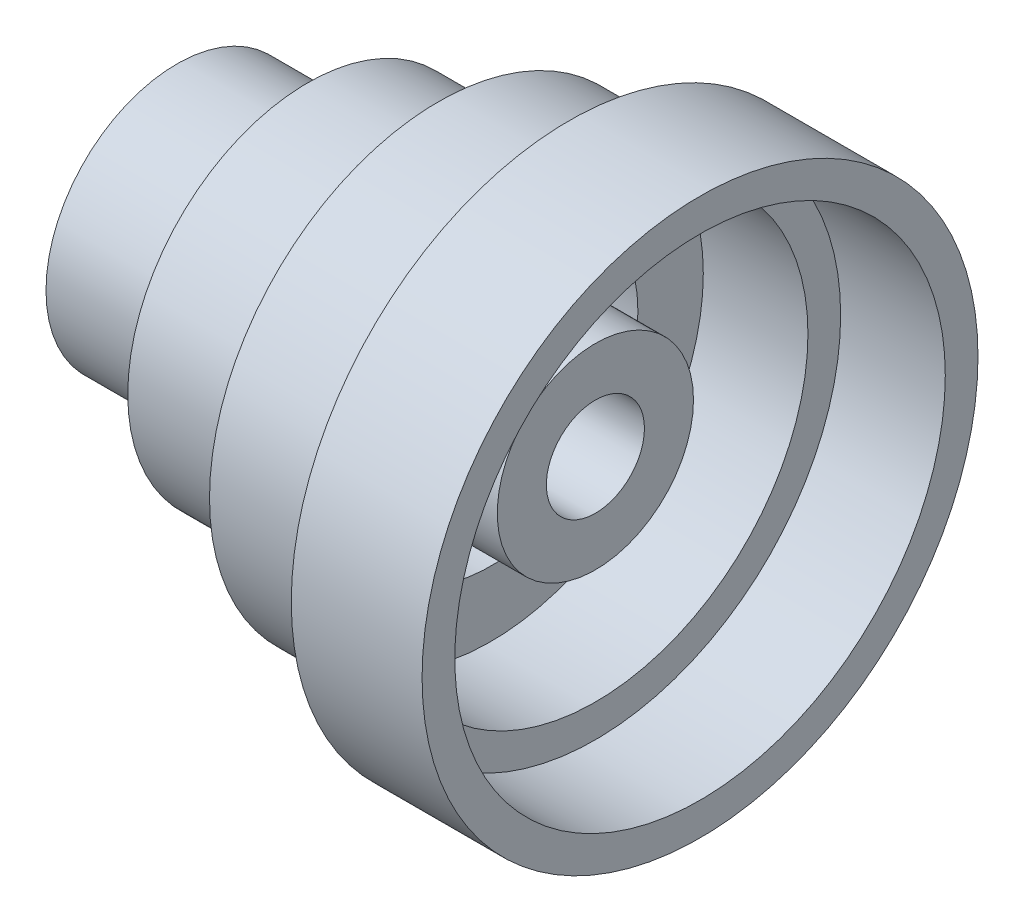
from build123d import *

# Parameters (mm, degrees)
SKETCH5_R                      = 1905
CUT_EXTRUDE2_DEPTH             = 812.8
SKETCH6_R                      = 1651
CUT_EXTRUDE3_DEPTH             = 812.8
SKETCH8_R                      = 1143
CUT_EXTRUDE5_DEPTH             = 812.8
SKETCH11_R                     = 762
BOSS_EXTRUDE2_DEPTH            = 3251.2
CUT_EXTRUDE7_REACH             = 5085.174
SKETCH12_R                     = 381
CUT_EXTRUDE7_DIRECTION_2_DEPTH = 5084.174008432


with BuildPart() as part:
    # Sketch1 → Revolve1 (revolve)
    with BuildSketch(Plane.XY, mode=Mode.PRIVATE) as revolve1_sk:
        Polygon((0, 381), (0, 1016), (1016, 1016), (1016, 1397), (2032, 1397), (2032, 1778), (3048, 1778), (3048, 2159), (4064, 2159), (4064, 381), align=None)
    revolve(revolve1_sk.sketch.rotate(Axis((0, 0, 0), (1, 0, 0)), 90), axis=Axis((0, 0, 0), (1, 0, 0)))

    # Sketch5 → Cut-Extrude2 (cut)
    with BuildSketch(Plane(origin=(4064, 0, 0), x_dir=(0, 0, -1), z_dir=(1, 0, 0))):
        Circle(SKETCH5_R)
    extrude(amount=-CUT_EXTRUDE2_DEPTH, mode=Mode.SUBTRACT)

    # Sketch6 → Cut-Extrude3 (cut)
    with BuildSketch(Plane(origin=(3251.2, 0, 0), x_dir=(0, 0, -1), z_dir=(1, 0, 0))):
        Circle(SKETCH6_R)
    extrude(amount=-CUT_EXTRUDE3_DEPTH, mode=Mode.SUBTRACT)

    # Sketch8 → Cut-Extrude5 (cut)
    with BuildSketch(Plane(origin=(2438.4, 0, 0), x_dir=(0, 0, -1), z_dir=(1, 0, 0))):
        Circle(SKETCH8_R)
    extrude(amount=-CUT_EXTRUDE5_DEPTH, mode=Mode.SUBTRACT)

    # Sketch11 → Boss-Extrude2 (add, through all)
    with BuildSketch(Plane(origin=(3251.2, 0, 0), x_dir=(0, 0, -1), z_dir=(1, 0, 0))):
        Circle(SKETCH11_R)
    extrude(amount=-BOSS_EXTRUDE2_DEPTH)

    # Sketch12 → Cut-Extrude7 (cut, up to next)
    with BuildSketch(Plane.ZY, mode=Mode.PRIVATE) as cut_extrude7_sk1:
        with Locations(Location((0, 0, 0), (0, 0, 180))):
            Circle(SKETCH12_R)
    cut_extrude7_tool1 = extrude(cut_extrude7_sk1.sketch, amount=-CUT_EXTRUDE7_REACH, mode=Mode.PRIVATE) & part.part
    add(cut_extrude7_tool1.solids().sort_by_distance((0, 0, 0))[0], mode=Mode.SUBTRACT)

    # Sketch12 → Cut-Extrude7 direction 2 (cut)
    with BuildSketch(Plane.ZY):
        with Locations(Location((0, 0, 0), (0, 0, 180))):
            Circle(SKETCH12_R)
    extrude(amount=CUT_EXTRUDE7_DIRECTION_2_DEPTH, mode=Mode.SUBTRACT)


solid = part.part
